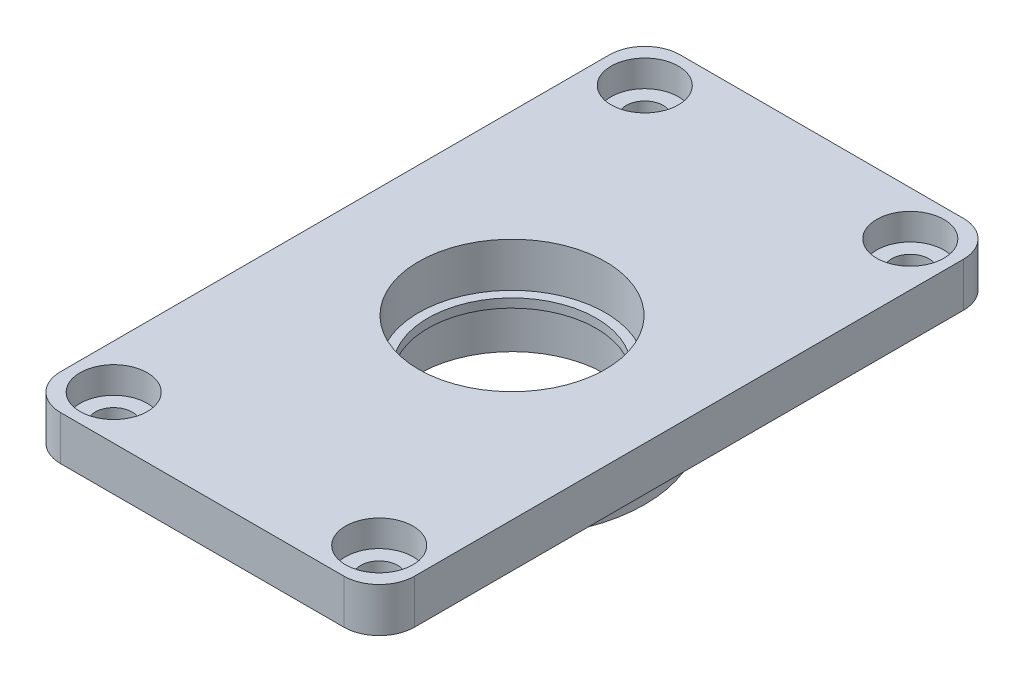
from build123d import *

# Parameters (mm, degrees)
SKETCH_1_W          = 40
SKETCH_1_H          = 70
SKETCH_1_R          = 2.1
EXTRUDE_1_DEPTH     = 11
SKETCH_2_R          = 9.5
CUT_EXTRUDE_1_DEPTH = 11
SKETCH_3_R          = 10.55
CUT_EXTRUDE_2_DEPTH = 5
CUT_EXTRUDE_START   = -5
SKETCH_4_R          = 10.55
CUT_EXTRUDE_3_DEPTH = 5
SKETCH_5_W          = 40
SKETCH_5_H          = 70
SKETCH_5_R          = 15
CUT_EXTRUDE_4_DEPTH = 6
SKETCH_6_R          = 3.8
CUT_EXTRUDE_5_DEPTH = 3
FILLET_1_R          = 4


with BuildPart() as part:
    # 草图1 → 凸台-拉伸1 (new body)
    with BuildSketch(Plane(origin=(0, 0, 0), x_dir=(1, 0, 0), z_dir=(0, 1, 0))):
        Rectangle(SKETCH_1_W, SKETCH_1_H)
        with Locations(Location((-15, -30, 0), (0, 0, 270))):
            Circle(SKETCH_1_R, mode=Mode.SUBTRACT)
        with Locations(Location((15, -30, 0), (0, 0, 90))):
            Circle(SKETCH_1_R, mode=Mode.SUBTRACT)
        with Locations(Location((15, 30, 0), (0, 0, 270))):
            Circle(SKETCH_1_R, mode=Mode.SUBTRACT)
        with Locations(Location((-15, 30, 0), (0, 0, 90))):
            Circle(SKETCH_1_R, mode=Mode.SUBTRACT)
    extrude(amount=EXTRUDE_1_DEPTH)

    # 草图2 → 切除-拉伸1 (cut)
    with BuildSketch(Plane(origin=(0, 11, 0), x_dir=(1, 0, 0), z_dir=(0, 1, 0))):
        with Locations(Location((0, 0, 0), (0, 0, 270))):
            Circle(SKETCH_2_R)
    extrude(amount=-CUT_EXTRUDE_1_DEPTH, mode=Mode.SUBTRACT)

    # 草图3 → 切除-拉伸2 (cut)
    with BuildSketch(Plane(origin=(0, 11, 0), x_dir=(1, 0, 0), z_dir=(0, 1, 0))):
        with Locations(Location((0, 0, 0), (0, 0, 270))):
            Circle(SKETCH_3_R)
    extrude(amount=-CUT_EXTRUDE_2_DEPTH, mode=Mode.SUBTRACT)

    # 草图4 → 切除-拉伸3 (cut)
    with BuildSketch(Plane.XZ.offset(CUT_EXTRUDE_START)):
        with Locations(Location((0, 0, 0), (0, 0, 90))):
            Circle(SKETCH_4_R)
    extrude(amount=CUT_EXTRUDE_3_DEPTH, mode=Mode.SUBTRACT)

    # 草图5 → 切除-拉伸4 (cut)
    with BuildSketch(Plane.XZ):
        Rectangle(SKETCH_5_W, SKETCH_5_H)
        with Locations(Location((0, 0, 0), (0, 0, 270))):
            Circle(SKETCH_5_R, mode=Mode.SUBTRACT)
    extrude(amount=-CUT_EXTRUDE_4_DEPTH, mode=Mode.SUBTRACT)

    # 草图6 → 切除-拉伸5 (cut)
    with BuildSketch(Plane(origin=(0, 11, 0), x_dir=(1, 0, 0), z_dir=(0, 1, 0))):
        with Locations(Location((-15, 30, 0), (0, 0, 270))):
            Circle(SKETCH_6_R)
        with Locations(Location((15, 30, 0), (0, 0, 270))):
            Circle(SKETCH_6_R)
        with Locations(Location((15, -30, 0), (0, 0, 90))):
            Circle(SKETCH_6_R)
        with Locations(Location((-15, -30, 0), (0, 0, 90))):
            Circle(SKETCH_6_R)
    extrude(amount=-CUT_EXTRUDE_5_DEPTH, mode=Mode.SUBTRACT)

    # 圆角1
    fillet_1_edges = [part.edges().sort_by_distance(p)[0] for p in [
        (20, 8.5, 35),
        (-20, 8.5, 35),
        (-20, 8.5, -35),
        (20, 8.5, -35),
    ]]
    fillet(fillet_1_edges, radius=FILLET_1_R)


solid = part.part
